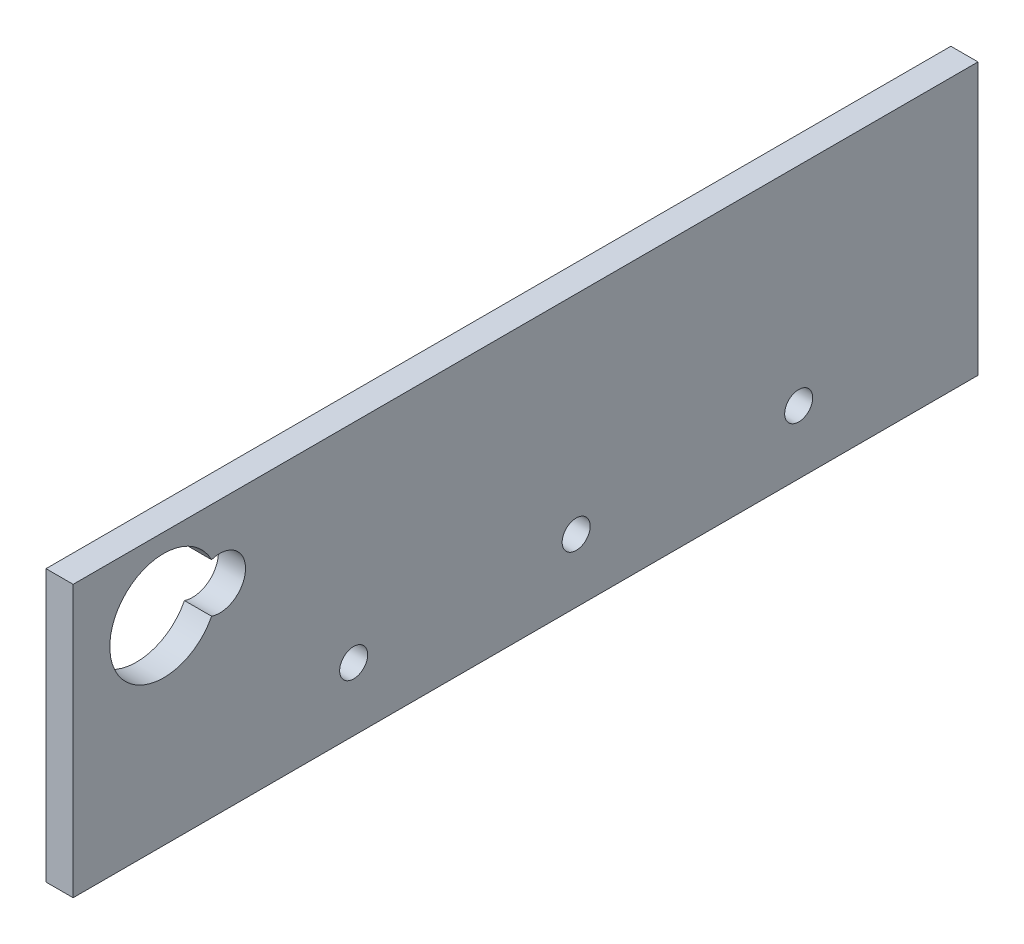
from build123d import *

# Parameters (mm, degrees)
SKIZZE1_W                       = 100
SKIZZE1_H                       = 30
AUFSATZ_LINEAR_AUSTRAGEN1_DEPTH = 3
SKIZZE2_R                       = 1.55
BOHRUNGEN_DEPTH                 = 105.446158378
SCHNITT_LINEAR_AUSTRAGEN3_DEPTH = 3


with BuildPart() as part:
    # Skizze1 → Aufsatz-Linear austragen1 (new body)
    with BuildSketch(Plane(origin=(0, 0, 0), x_dir=(0, 0, -1), z_dir=(1, 0, 0))):
        with Locations((50, 15)):
            Rectangle(SKIZZE1_W, SKIZZE1_H)
    extrude(amount=AUFSATZ_LINEAR_AUSTRAGEN1_DEPTH)

    # Skizze2 → Bohrungen (cut, through all)
    with BuildSketch(Plane(origin=(3, 0, 0), x_dir=(0, 0, -1), z_dir=(1, 0, 0))):
        with Locations((10, 22)):
            Circle(SKIZZE2_R)
        with Locations((31, 7)):
            Circle(SKIZZE2_R)
        with Locations((55.59187467, 7)):
            Circle(SKIZZE2_R)
        with Locations((80.183749339, 7)):
            Circle(SKIZZE2_R)
    extrude(amount=-BOHRUNGEN_DEPTH, mode=Mode.SUBTRACT)

    # Skizze6 → Schnitt-Linear austragen3 (cut)
    with BuildSketch(Plane.ZY):
        with BuildLine():
            ThreePointArc((-15.3, 19.295836543), (-4.05, 22), (-15.3, 24.704163457))
            ThreePointArc((-15.3, 24.704163457), (-19.05, 22), (-15.3, 19.295836543))
        make_face()
    extrude(amount=-SCHNITT_LINEAR_AUSTRAGEN3_DEPTH, mode=Mode.SUBTRACT)


solid = part.part
